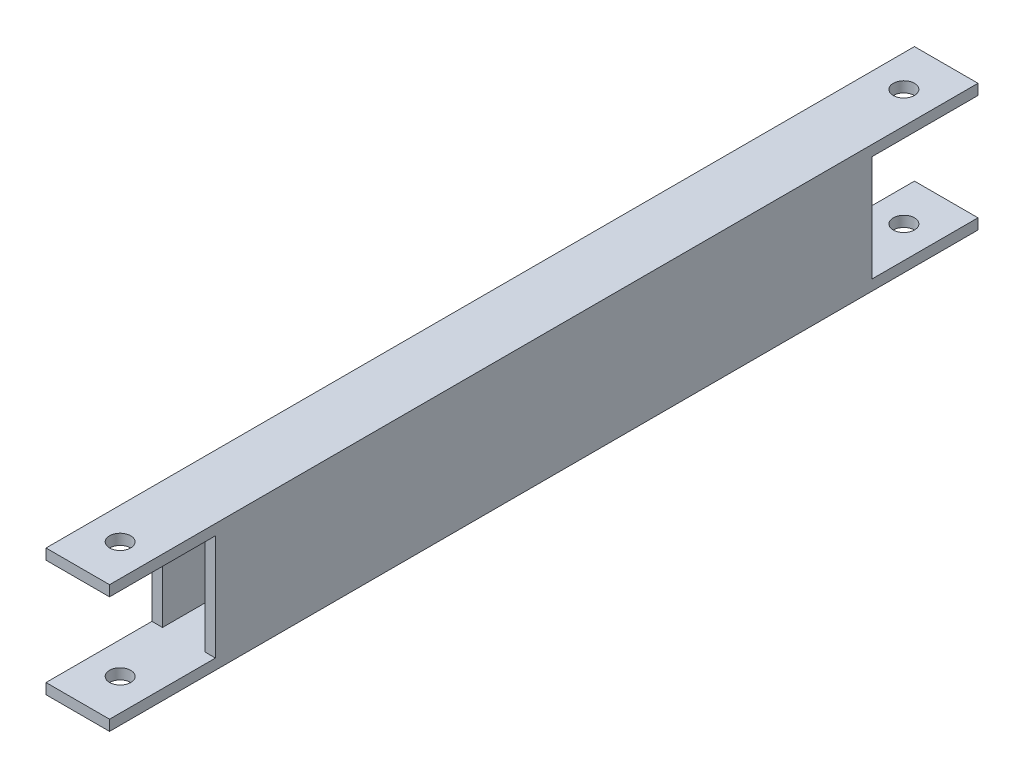
from build123d import *

# Parameters (mm, degrees)
SKETCH1_W           = 19.05
SKETCH1_H           = 38.1
SKETCH1_W_2         = 12.7
SKETCH1_H_2         = 31.75
BOSS_EXTRUDE1_DEPTH = 260.35
SKETCH2_W           = 19.05
SKETCH2_H           = 31.75
CUT_EXTRUDE1_DEPTH  = 31.75
SKETCH3_R           = 3.175
CUT_EXTRUDE2_DEPTH  = 264.811741589


with BuildPart() as part:
    # Sketch1 → Boss-Extrude1 (new body)
    with BuildSketch(Plane.XY):
        with Locations((9.525, 19.05)):
            Rectangle(SKETCH1_W, SKETCH1_H)
        with Locations((9.525, 19.05)):
            Rectangle(SKETCH1_W_2, SKETCH1_H_2, mode=Mode.SUBTRACT)
    extrude(amount=BOSS_EXTRUDE1_DEPTH)

    # Sketch2 → Cut-Extrude1 (cut)
    with BuildSketch(Plane.XY.offset(260.35)):
        with Locations((9.525, 19.05)):
            Rectangle(SKETCH2_W, SKETCH2_H)
    cut_extrude1 = extrude(amount=-CUT_EXTRUDE1_DEPTH, mode=Mode.SUBTRACT)

    # Sketch3 → Cut-Extrude2 (cut, through all)
    with BuildSketch(Plane(origin=(0, 38.1, 0), x_dir=(1, 0, 0), z_dir=(0, 1, 0))):
        with Locations(Location((9.525, -247.65, 0), (0, 0, 180))):
            Circle(SKETCH3_R)
    cut_extrude2 = extrude(amount=-CUT_EXTRUDE2_DEPTH, mode=Mode.SUBTRACT)

    # Mirror1: Cut-Extrude1, Cut-Extrude2 across plane
    add(cut_extrude1.mirror(Plane.XY.offset(130.175)), mode=Mode.SUBTRACT)
    add(cut_extrude2.mirror(Plane.XY.offset(130.175)), mode=Mode.SUBTRACT)


solid = part.part
